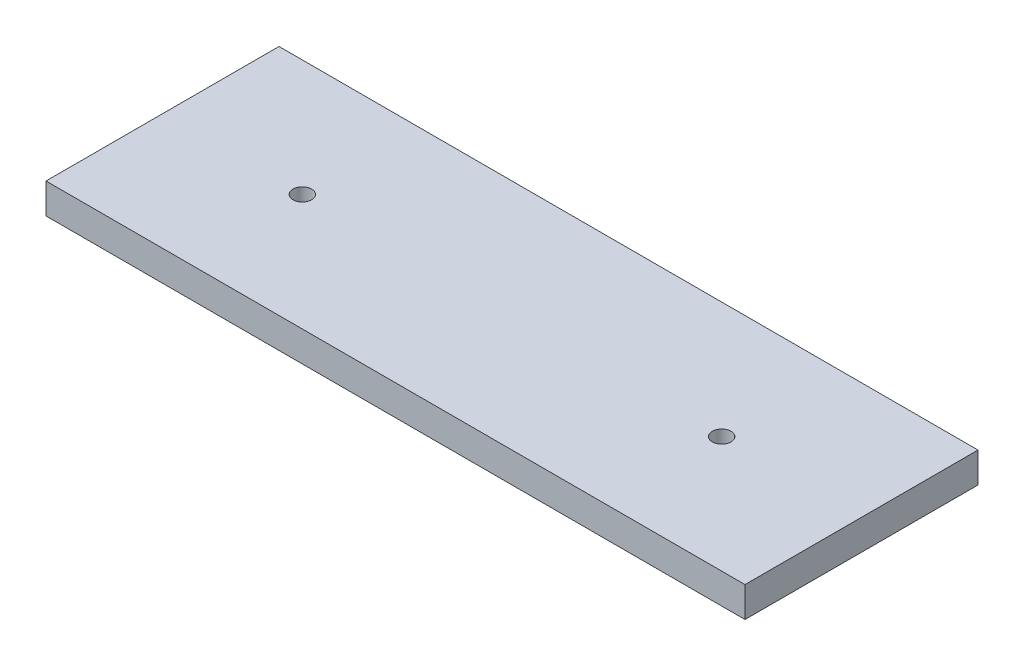
from build123d import *

# Parameters (mm, degrees)
SKETCH1_W           = 150
SKETCH1_H           = 50
BOSS_EXTRUDE1_DEPTH = 6.5
SKETCH3_R           = 5
BOSS_EXTRUDE2_DEPTH = 17.5
FILLET1_R           = 5
SKETCH4_R           = 3.2
CUT_EXTRUDE1_DEPTH  = 17.5
SKETCH5_R           = 2
CUT_EXTRUDE2_DEPTH  = 6.5


with BuildPart() as part:
    # Sketch1 → Boss-Extrude1 (new body)
    with BuildSketch(Plane(origin=(0, 0, 0), x_dir=(1, 0, 0), z_dir=(0, 1, 0))):
        Rectangle(SKETCH1_W, SKETCH1_H)
    extrude(amount=BOSS_EXTRUDE1_DEPTH)

    # Sketch3 → Boss-Extrude2 (add)
    with BuildSketch(Plane.XZ):
        with Locations(Location((45, 0, 0), (0, 0, 90))):
            Circle(SKETCH3_R)
        with Locations(Location((-45, 0, 0), (0, 0, 90))):
            Circle(SKETCH3_R)
    extrude(amount=BOSS_EXTRUDE2_DEPTH)

    # Fillet1
    fillet1_edges = [part.edges().sort_by_distance(p)[0] for p in [
        (45, 0, -5),
        (-45, 0, -5),
    ]]
    fillet(fillet1_edges, radius=FILLET1_R)

    # Sketch4 → Cut-Extrude1 (cut)
    with BuildSketch(Plane.XZ.offset(17.5)):
        with Locations(Location((45, 0, 0), (0, 0, 270))):
            Circle(SKETCH4_R)
        with Locations(Location((-45, 0, 0), (0, 0, 270))):
            Circle(SKETCH4_R)
    extrude(amount=-CUT_EXTRUDE1_DEPTH, mode=Mode.SUBTRACT)

    # Sketch5 → Cut-Extrude2 (cut)
    with BuildSketch(Plane.XZ):
        with Locations(Location((45, 0, 0), (0, 0, 270))):
            Circle(SKETCH5_R)
        with Locations(Location((-45, 0, 0), (0, 0, 270))):
            Circle(SKETCH5_R)
    extrude(amount=-CUT_EXTRUDE2_DEPTH, mode=Mode.SUBTRACT)


solid = part.part
